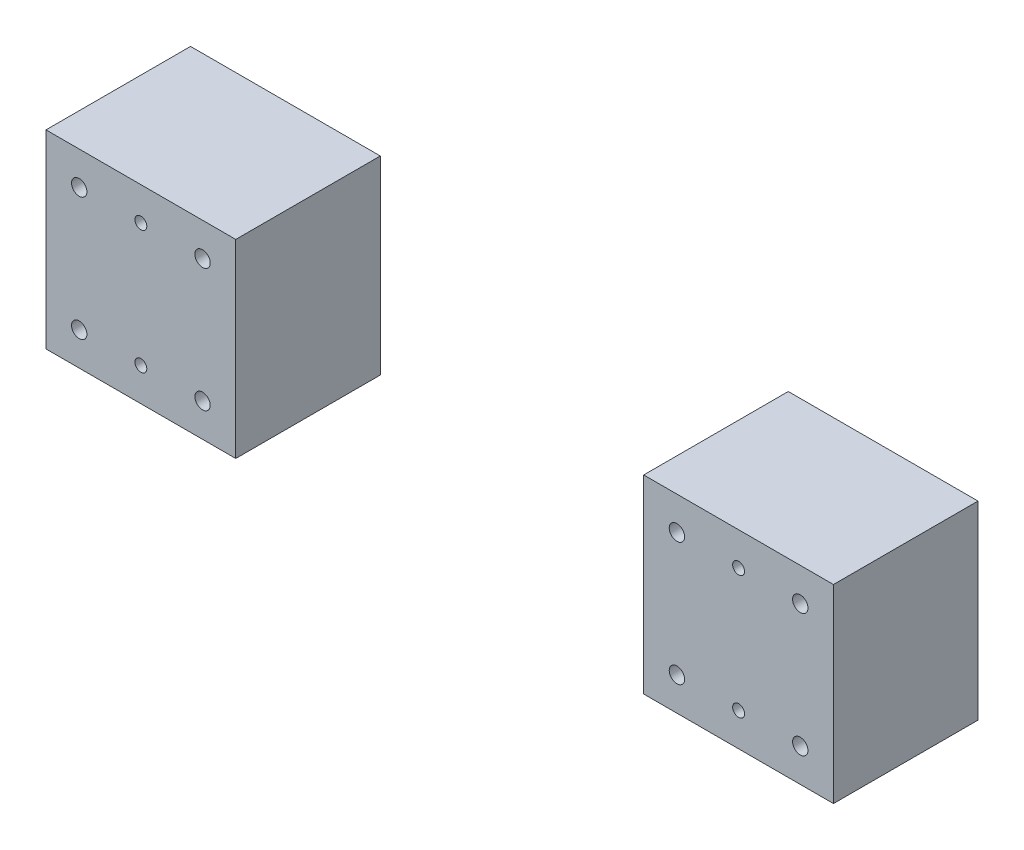
from build123d import *

# Parameters (mm, degrees)
SKETCH1_W                      = 40
SKETCH1_H                      = 40
SKETCH1_R                      = 1.621
BOSS_EXTRUDE1_DEPTH            = 30.47
BOSS_EXTRUDE1_2_DEPTH          = 30.47
SKETCH4_R                      = 4.2
CUT_EXTRUDE1_DEPTH             = 20
SKETCH7_W                      = 1.25
SKETCH7_H                      = 30.47
M3X0_5_TAPPED_HOLE1_AT_2_COUNT = 2
M3X0_5_TAPPED_HOLE1_AT_2_PITCH = 26
M3X0_5_TAPPED_HOLE1_AT_3_COUNT = 2
M3X0_5_TAPPED_HOLE1_AT_3_PITCH = 128.654576289
M3X0_5_TAPPED_HOLE1_AT_4_COUNT = 2
M3X0_5_TAPPED_HOLE1_AT_4_PITCH = 126


with BuildPart() as part:
    # Sketch1 → Boss-Extrude1 (new body)
    with BuildSketch(Plane(origin=(0, 0, 0), x_dir=(-1, 0, 0), z_dir=(0, 0, 1))):
        with Locations((-20, -20)):
            Rectangle(SKETCH1_W, SKETCH1_H)
        with Locations((-33, -7)):
            Circle(SKETCH1_R, mode=Mode.SUBTRACT)
        with Locations((-7, -7)):
            Circle(SKETCH1_R, mode=Mode.SUBTRACT)
        with Locations((-7, -33)):
            Circle(SKETCH1_R, mode=Mode.SUBTRACT)
        with Locations((-33, -33)):
            Circle(SKETCH1_R, mode=Mode.SUBTRACT)
    extrude(amount=BOSS_EXTRUDE1_DEPTH)


with BuildPart() as body_2:
    # Sketch1 → Boss-Extrude1 2 (new body)
    with BuildSketch(Plane(origin=(0, 0, 0), x_dir=(-1, 0, 0), z_dir=(0, 0, 1))):
        with Locations((-146, -20)):
            Rectangle(SKETCH1_W, SKETCH1_H)
        with Locations((-159, -7)):
            Circle(SKETCH1_R, mode=Mode.SUBTRACT)
        with Locations((-133, -7)):
            Circle(SKETCH1_R, mode=Mode.SUBTRACT)
        with Locations((-133, -33)):
            Circle(SKETCH1_R, mode=Mode.SUBTRACT)
        with Locations((-159, -33)):
            Circle(SKETCH1_R, mode=Mode.SUBTRACT)
    extrude(amount=BOSS_EXTRUDE1_2_DEPTH)


with BuildPart() as cut_extrude1_tool:
    # Sketch4 → Cut-Extrude1 (new body)
    with BuildSketch(Plane(origin=(0, 0, 0), x_dir=(-1, 0, 0), z_dir=(0, 0, -1))):
        with Locations((-7, 7)):
            Circle(SKETCH4_R)
        with Locations((-33, 7)):
            Circle(SKETCH4_R)
        with Locations((-7, 33)):
            Circle(SKETCH4_R)
        with Locations((-33, 33)):
            Circle(SKETCH4_R)
        with Locations((-133, 7)):
            Circle(SKETCH4_R)
        with Locations((-133, 33)):
            Circle(SKETCH4_R)
        with Locations((-159, 33)):
            Circle(SKETCH4_R)
        with Locations((-159, 7)):
            Circle(SKETCH4_R)
    extrude(amount=-CUT_EXTRUDE1_DEPTH)


with BuildPart() as part_1:
    add(part.part)

    # Cut-Extrude1: cut by cut_extrude1_tool
    add(cut_extrude1_tool.part, mode=Mode.SUBTRACT)

    # Sketch7 → M3x0.5 Tapped Hole1 (revolve, cut)
    with BuildSketch(Plane(origin=(20, 7, 0), x_dir=(0, 1, 0), z_dir=(1, 0, 0))):
        with Locations((0.625, 15.235)):
            Rectangle(SKETCH7_W, SKETCH7_H)
    m3x0_5_tapped_hole1 = revolve(axis=Axis((20, 7, -6.35), (0, 0, 1)), mode=Mode.SUBTRACT)

    # M3x0.5 Tapped Hole1 at 2: M3x0.5 Tapped Hole1 ×2
    with Locations(*[(0, i * M3X0_5_TAPPED_HOLE1_AT_2_PITCH, 0) for i in range(1, M3X0_5_TAPPED_HOLE1_AT_2_COUNT)]):
        add(m3x0_5_tapped_hole1, mode=Mode.SUBTRACT)


with BuildPart() as body_2_1:
    add(body_2.part)

    # Cut-Extrude1: cut by cut_extrude1_tool
    add(cut_extrude1_tool.part, mode=Mode.SUBTRACT)

    # M3x0.5 Tapped Hole1 at 3: M3x0.5 Tapped Hole1 ×2
    with Locations(*[Vector(0.9793666392196709, 0.20209152872786895, 0) * (i * M3X0_5_TAPPED_HOLE1_AT_3_PITCH) for i in range(1, M3X0_5_TAPPED_HOLE1_AT_3_COUNT)]):
        add(m3x0_5_tapped_hole1, mode=Mode.SUBTRACT)

    # M3x0.5 Tapped Hole1 at 4: M3x0.5 Tapped Hole1 ×2
    with Locations(*[(i * M3X0_5_TAPPED_HOLE1_AT_4_PITCH, 0, 0) for i in range(1, M3X0_5_TAPPED_HOLE1_AT_4_COUNT)]):
        add(m3x0_5_tapped_hole1, mode=Mode.SUBTRACT)


solid = Compound([part_1.part, body_2_1.part])
